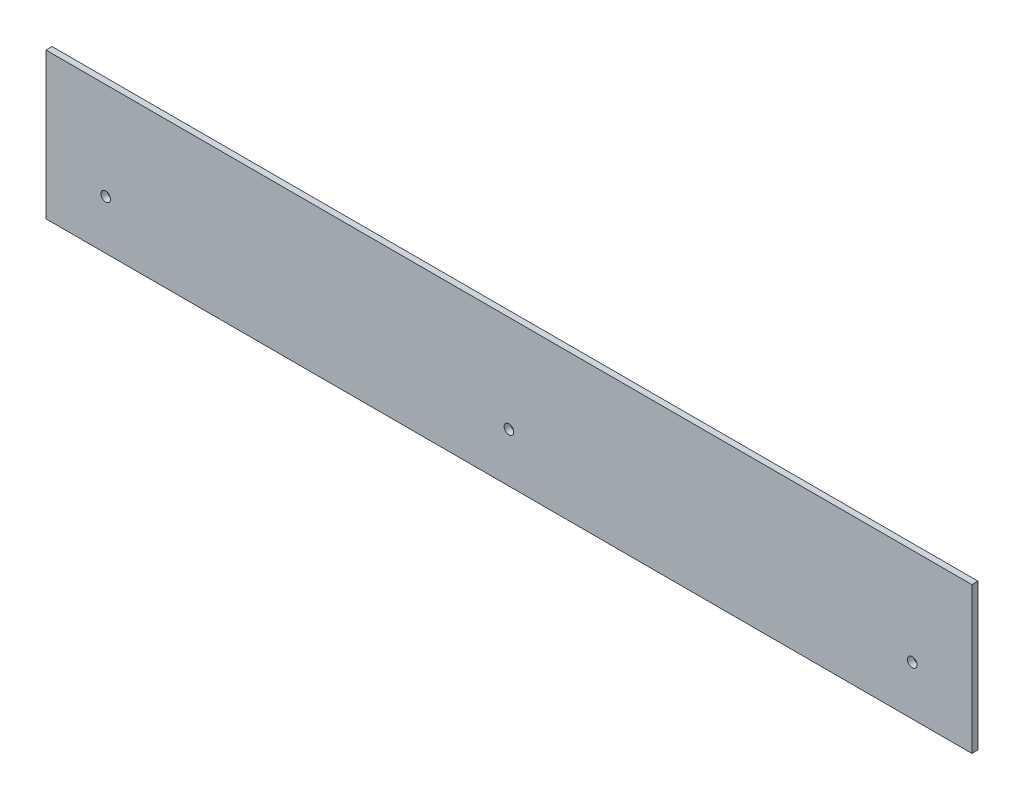
from build123d import *

# Parameters (mm, degrees)
SKETCH1_W           = 482.6
SKETCH1_H           = 76.2
BOSS_EXTRUDE1_DEPTH = 3.175
SKETCH2_R           = 2.5
CUT_EXTRUDE1_DEPTH  = 245.310009261


with BuildPart() as part:
    # Sketch1 → Boss-Extrude1 (new body)
    with BuildSketch(Plane.XY):
        Rectangle(SKETCH1_W, SKETCH1_H)
    extrude(amount=BOSS_EXTRUDE1_DEPTH)

    # Sketch2 → Cut-Extrude1 (cut, through all)
    with BuildSketch(Plane.XY.offset(3.175)):
        with Locations((-210.185, -12.446)):
            Circle(SKETCH2_R)
        with Locations(Location((210.185, -12.446, 0), (0, 0, 180))):
            Circle(SKETCH2_R)
        with Locations((0, -12.446)):
            Circle(SKETCH2_R)
    extrude(amount=-CUT_EXTRUDE1_DEPTH, mode=Mode.SUBTRACT)


solid = part.part
